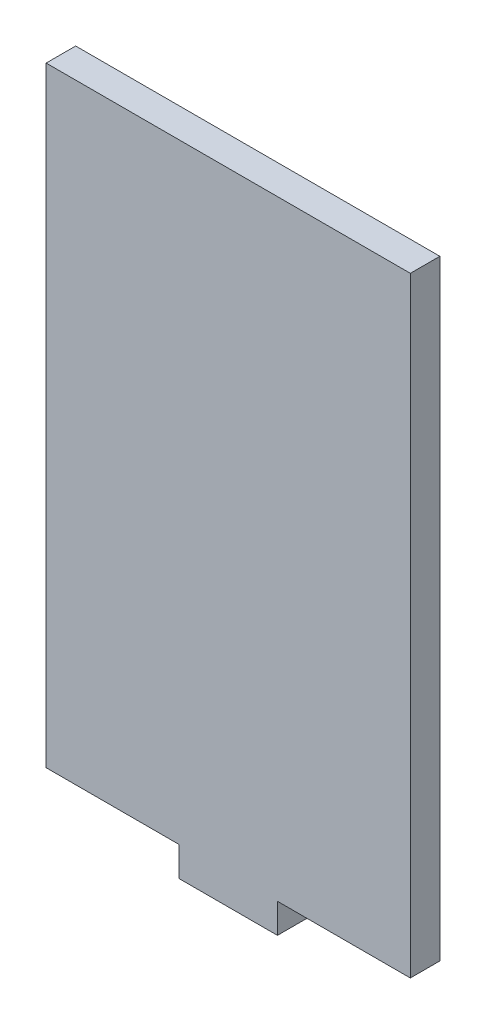
from build123d import *

# Parameters (mm, degrees)
BOSS_EXTRU_1_DEPTH = 3


with BuildPart() as part:
    # Esquisse1 → Boss.-Extru.1 (new body)
    with BuildSketch(Plane.XY):
        Polygon((23.5, 0), (37, 0), (37, 62), (0, 62), (0, 0), (13.5, 0), (13.5, -3), (23.5, -3), align=None)
    extrude(amount=BOSS_EXTRU_1_DEPTH)


solid = part.part
